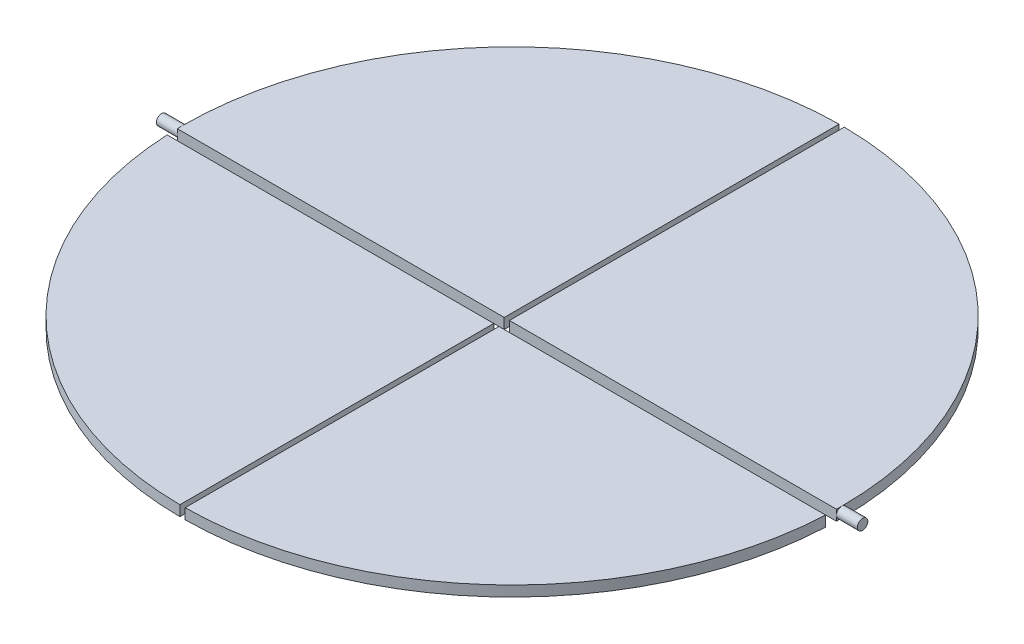
from build123d import *

# Parameters (mm, degrees)
SKETCH_1_R           = 63
EXTRUDE_1_DEPTH      = 2
EXTRUDE_2_DEPTH      = 67
EXTRUDE_2_DEPTH_BACK = 67
SKETCH_4_R           = 1
CUT_EXTRUDE_2_DEPTH  = 92.989129936
CUT_EXTRUDE_4_DEPTH  = 92.989129936
SKETCH_9_W           = 1
SKETCH_9_H           = 75.08863074
CUT_EXTRUDE_5_DEPTH  = 92.989129868


with BuildPart() as part:
    # Эскиз1 → Бобышка-Вытянуть1 (new body)
    with BuildSketch(Plane(origin=(0, 0, 0), x_dir=(1, 0, 0), z_dir=(0, 1, 0))):
        Circle(SKETCH_1_R)
    extrude(amount=EXTRUDE_1_DEPTH)

    # Эскиз4 → Бобышка-Вытянуть2 (add, two sides: drawn at the far end of the back side and taken through both)
    with BuildSketch(Plane(origin=(0, 0, 0), x_dir=(0, 0, -1), z_dir=(1, 0, 0)).offset(-EXTRUDE_2_DEPTH_BACK)):
        with Locations((0, 1)):
            Circle(SKETCH_4_R)
    extrude(amount=EXTRUDE_2_DEPTH + EXTRUDE_2_DEPTH_BACK)

    # Эскиз5 → Вырез-Вытянуть2 (cut, through all)
    with BuildSketch(Plane(origin=(0, 2, 0), x_dir=(1, 0, 0), z_dir=(0, 1, 0))):
        with BuildLine():
            Line((62.992062992, -1), (-62.992063039, -1))
            ThreePointArc((-62.992062992, -0.999999999), (-62.968237953, -2.000252254), (-62.92853089, -3))
            Line((-62.92853089, -3), (62.92853089, -3))
            ThreePointArc((62.92853089, -3), (62.968237953, -2.000252255), (62.992062992, -1))
        make_face()
    extrude(amount=-CUT_EXTRUDE_2_DEPTH, mode=Mode.SUBTRACT)


with BuildPart() as cut_extrude_2_piece_1:
    # of the separate pieces the step leaves, piece 1, a body of its own (cut_extrude_2_pieces)
    add(part.part.solids().sort_by_distance((63, 0, 0))[0])

    # Эскиз8 → Вырез-Вытянуть4 (cut, through all)
    with BuildSketch(Plane(origin=(0, 2, 0), x_dir=(1, 0, 0), z_dir=(0, 1, 0))):
        Polygon((0, 66.190632404), (-0.5, 66.190632404), (-0.5, -2.025113876), (0.5, -2.025113876), (0.5, 66.190632404), align=None)
    extrude(amount=-CUT_EXTRUDE_4_DEPTH, mode=Mode.SUBTRACT)


with BuildPart() as cut_extrude_2_piece_2:
    # of the separate pieces the step leaves, piece 2, a body of its own (cut_extrude_2_pieces)
    add(part.part.solids().sort_by_distance((-62.92853089, 0, 3))[0])

    # Эскиз9 → Вырез-Вытянуть5 (cut, through all)
    with BuildSketch(Plane(origin=(0, 2, 0), x_dir=(1, 0, 0), z_dir=(0, 1, 0))):
        with Locations((0, -38.54431537)):
            Rectangle(SKETCH_9_W, SKETCH_9_H)
    extrude(amount=-CUT_EXTRUDE_5_DEPTH, mode=Mode.SUBTRACT)


with BuildPart() as cut_extrude_4_piece_1:
    # of the separate pieces the step leaves, piece 1, a body of its own (cut_extrude_4_pieces)
    add(cut_extrude_2_piece_1.part.solids().sort_by_distance((-0.5, 0, -62.998015842))[0])


with BuildPart() as cut_extrude_4_piece_2:
    # of the separate pieces the step leaves, piece 2, a body of its own (cut_extrude_4_pieces)
    add(cut_extrude_2_piece_1.part.solids().sort_by_distance((63, 0, 0))[0])


with BuildPart() as cut_extrude_5_piece_1:
    # of the separate pieces the step leaves, piece 1, a body of its own (cut_extrude_5_pieces)
    add(cut_extrude_2_piece_2.part.solids().sort_by_distance((-62.92853089, 0, 3))[0])


with BuildPart() as cut_extrude_5_piece_2:
    # of the separate pieces the step leaves, piece 2, a body of its own (cut_extrude_5_pieces)
    add(cut_extrude_2_piece_2.part.solids().sort_by_distance((0.5, 0, 62.998015842))[0])


solid = Compound([cut_extrude_4_piece_1.part, cut_extrude_4_piece_2.part, cut_extrude_5_piece_1.part, cut_extrude_5_piece_2.part])
